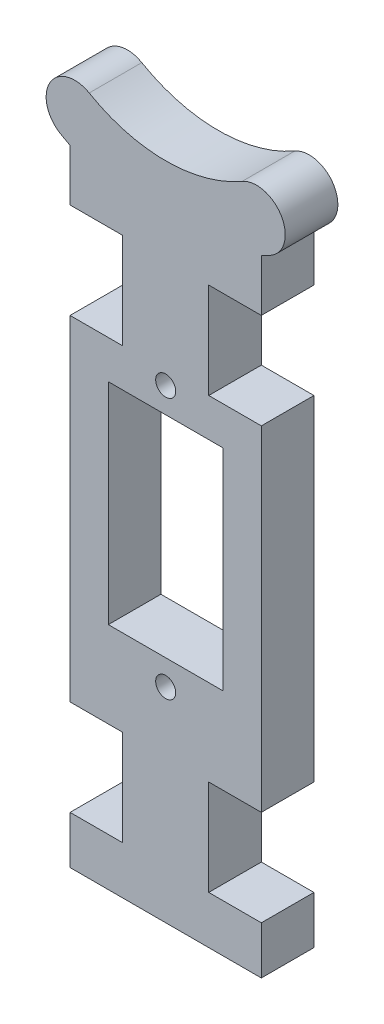
from build123d import *

# Parameters (mm, degrees)
EXTRUDE_1_DEPTH     = 5.5
SKETCH_3_R          = 1.05
SKETCH_3_W          = 12
SKETCH_3_H          = 22
CUT_EXTRUDE_2_DEPTH = 87.090069114
SKETCH_2_W          = 5.5
SKETCH_2_H          = 10
CUT_EXTRUDE_3_DEPTH = 87.090069114


with BuildPart() as part:
    # ｽｹｯﾁ1 → ﾎﾞｽ - 押し出し1 (new body)
    with BuildSketch(Plane.XY):
        with BuildLine():
            Line((-10, -19.595917942), (-10, -85))
            Line((-10, -85), (10, -85))
            Line((10, -85), (10, -19.595917942))
            ThreePointArc((10, -19.595917942), (10.503514163, -19.330705891), (11, -19.052558883))
            ThreePointArc((11, -19.052558883), (12.098076211, -14.954482672), (8, -13.856406461))
            ThreePointArc((8, -13.856406461), (0, -16), (-8, -13.856406461))
            ThreePointArc((-8, -13.856406461), (-12.098076211, -14.954482672), (-11, -19.052558883))
            ThreePointArc((-11, -19.052558883), (-10.503514163, -19.330705891), (-10, -19.595917942))
        make_face()
    extrude(amount=EXTRUDE_1_DEPTH)

    # ｽｹｯﾁ3 → ｶｯﾄ - 押し出し2 (cut, through all)
    with BuildSketch(Plane.XY.offset(5.5)):
        with Locations((0, -36.35)):
            Circle(SKETCH_3_R)
        with Locations((0, -63.65)):
            Circle(SKETCH_3_R)
        with Locations((0, -50)):
            Rectangle(SKETCH_3_W, SKETCH_3_H)
    extrude(amount=-CUT_EXTRUDE_2_DEPTH, mode=Mode.SUBTRACT)

    # ｽｹｯﾁ2 → ｶｯﾄ - 押し出し3 (cut, through all)
    with BuildSketch(Plane.XY.offset(5.5)):
        with Locations((-7.25, -75)):
            Rectangle(SKETCH_2_W, SKETCH_2_H)
        with Locations((-7.25, -30)):
            Rectangle(SKETCH_2_W, SKETCH_2_H)
        with Locations((7.25, -75)):
            Rectangle(SKETCH_2_W, SKETCH_2_H)
        with Locations((7.25, -30)):
            Rectangle(SKETCH_2_W, SKETCH_2_H)
    extrude(amount=-CUT_EXTRUDE_3_DEPTH, mode=Mode.SUBTRACT)


solid = part.part
